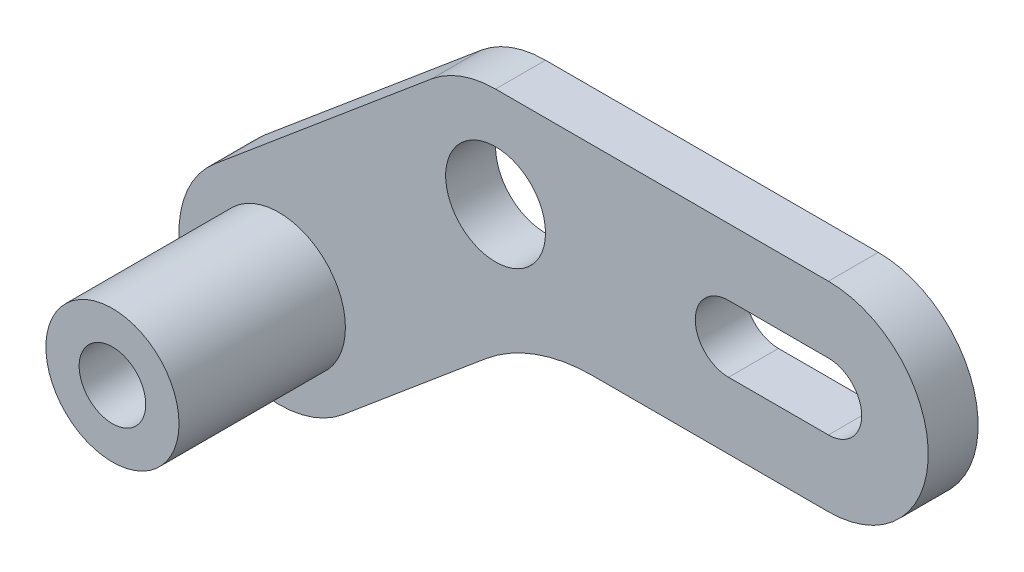
from build123d import *

# Parameters (mm, degrees)
SKETCH_1_R      = 3
SKETCH_1_R_2    = 2
EXTRUDE_1_DEPTH = 3
FILLET_1_R      = 10
SKETCH_2_R      = 4
SKETCH_2_R_2    = 2
EXTRUDE_2_DEPTH = 10


with BuildPart() as part:
    # Эскиз1 → Бобышка-Вытянуть1 (new body)
    with BuildSketch(Plane.XY):
        with BuildLine():
            Line((-17.816178594, -6), (0, -6))
            ThreePointArc((0, -6), (6, 0), (0, 6))
            Line((0, 6), (-20, 6))
            ThreePointArc((-20, 6), (-22.05212086, 5.638155725), (-23.856725658, 4.596266659))
            Line((-23.856725658, 4.596266659), (-36.879481191, -6.331122706))
            ThreePointArc((-36.879481191, -6.331122706), (-37.619022192, -14.784115023), (-29.166029875, -15.523656023))
            Line((-29.166029875, -15.523656023), (-17.816178594, -6))
        make_face()
        with Locations((-20, 0)):
            Circle(SKETCH_1_R, mode=Mode.SUBTRACT)
        with BuildLine():
            Line((-6, 2), (0, 2))
            ThreePointArc((0, 2), (2, 0), (0, -2))
            Line((0, -2), (-6, -2))
            ThreePointArc((-6, -2), (-8, 0), (-6, 2))
        make_face(mode=Mode.SUBTRACT)
        with Locations((-33.022755533, -10.927389365)):
            Circle(SKETCH_1_R_2, mode=Mode.SUBTRACT)
    extrude(amount=EXTRUDE_1_DEPTH)

    # Скругление1
    fillet_1_edges = [part.edges().sort_by_distance(p)[0] for p in [
        (-17.816178594, -6, 1.5),
    ]]
    fillet(fillet_1_edges, radius=FILLET_1_R)

    # Эскиз2 → Бобышка-Вытянуть2 (add)
    with BuildSketch(Plane.XY.offset(3)):
        with Locations((-33.022755533, -10.927389365)):
            Circle(SKETCH_2_R)
        with Locations((-33.022755533, -10.927389365)):
            Circle(SKETCH_2_R_2, mode=Mode.SUBTRACT)
    extrude(amount=EXTRUDE_2_DEPTH)


solid = part.part
